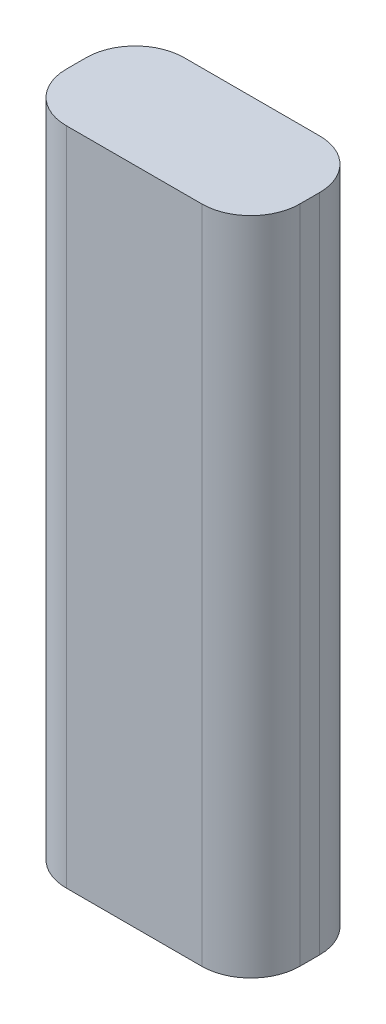
from build123d import *

# Parameters (mm, degrees)
SKETCH_1_W      = 47.67
SKETCH_1_H      = 134.79
EXTRUDE_1_DEPTH = 24.06
FILLET_1_R      = 10


with BuildPart() as part:
    # ｽｹｯﾁ1 → ﾎﾞｽ - 押し出し1 (new body)
    with BuildSketch(Plane.XY):
        Rectangle(SKETCH_1_W, SKETCH_1_H)
    extrude(amount=EXTRUDE_1_DEPTH)

    # ﾌｨﾚｯﾄ1
    fillet_1_edges = [part.edges().sort_by_distance(p)[0] for p in [
        (23.835, 0, 24.06),
        (-23.835, 0, 24.06),
        (23.835, 0, 0),
        (-23.835, 0, 0),
    ]]
    fillet(fillet_1_edges, radius=FILLET_1_R)


solid = part.part
